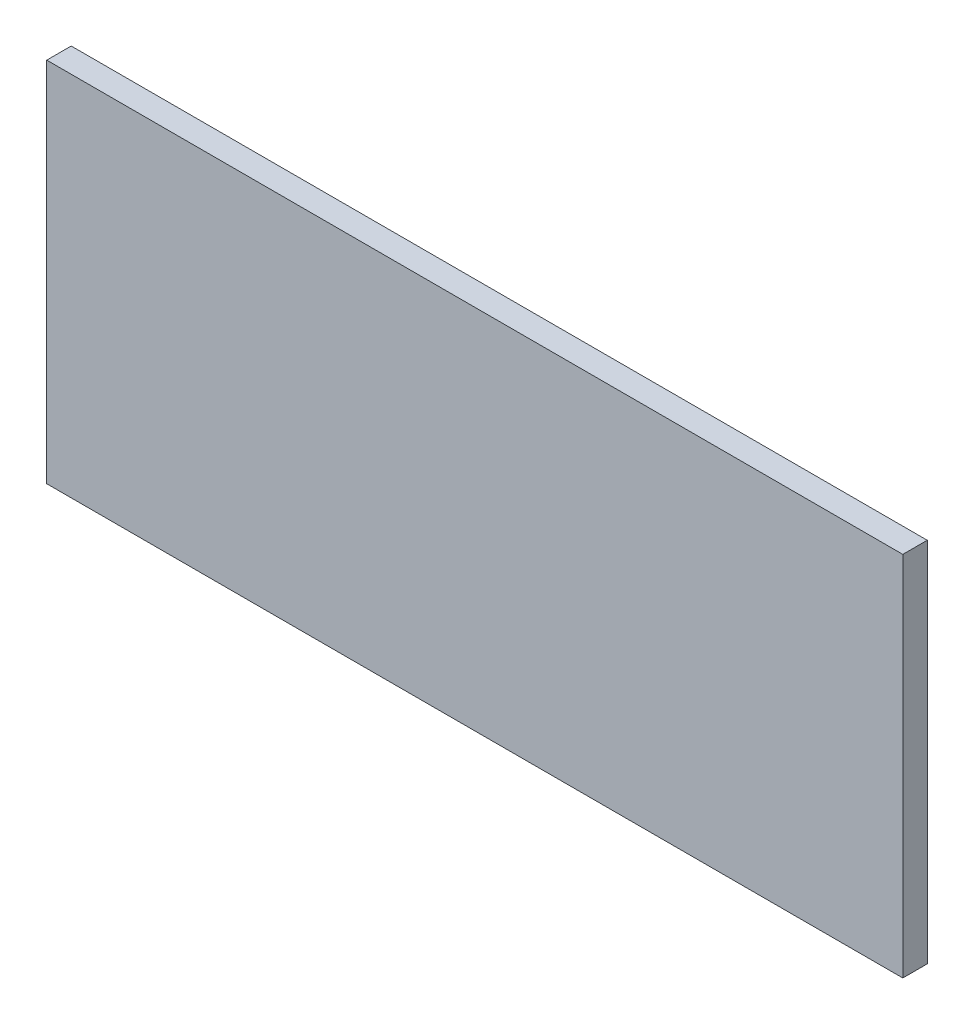
from build123d import *

# Parameters (mm, degrees)
IZIM1_W                     = 140
IZIM1_H                     = 60
Y_KSEKLIK_EKSTR_ZYON1_DEPTH = 4


with BuildPart() as part:
    # Çizim1 → Yükseklik-Ekstrüzyon1 (new body)
    with BuildSketch(Plane.XY):
        with Locations((-70, 30)):
            Rectangle(IZIM1_W, IZIM1_H)
    extrude(amount=Y_KSEKLIK_EKSTR_ZYON1_DEPTH)


solid = part.part
